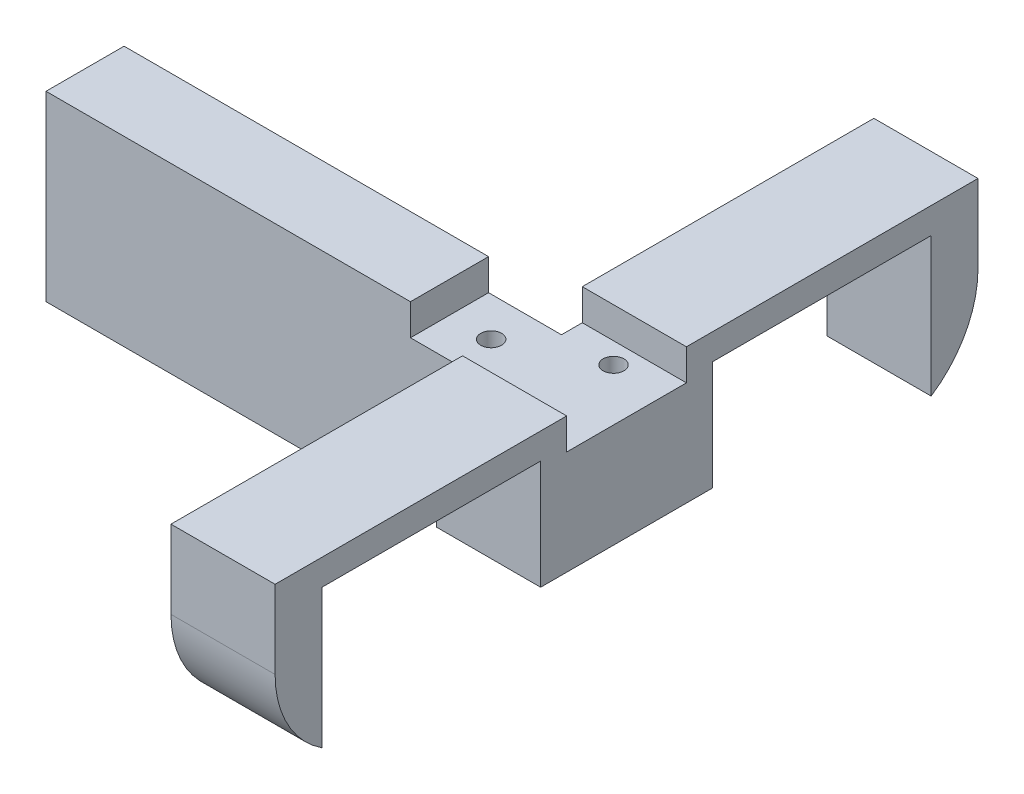
from build123d import *

# Parameters (mm, degrees)
BOSS_EXTRUDE1_DEPTH = 35
CUT_EXTRUDE1_REACH  = 163.307
SKETCH2_W           = 42
SKETCH2_H           = 21
SKETCH3_R           = 2
CUT_EXTRUDE2_DEPTH  = 10
FILLET1_R           = 20
CUT_EXTRUDE5_REACH  = 163.307
SKETCH6_W           = 42
SKETCH6_H           = 9
SKETCH7_R           = 2
CUT_EXTRUDE6_DEPTH  = 10
CUT_EXTRUDE7_DEPTH  = 9
SKETCH9_R           = 2
CUT_EXTRUDE8_DEPTH  = 10
CUT_EXTRUDE9_DEPTH  = 6
SKETCH11_R          = 2
CUT_EXTRUDE10_DEPTH = 9


with BuildPart() as part:
    # Sketch1 → Boss-Extrude1 (new body)
    with BuildSketch(Plane(origin=(0, 0, 0), x_dir=(1, 0, 0), z_dir=(0, 1, 0))):
        Polygon((-38.317617866, 43.23325062), (45.682382134, 43.23325062), (45.682382134, -16.76674938), (65.682382134, -16.76674938), (65.682382134, 118.23325062), (45.682382134, 118.23325062), (45.682382134, 58.23325062), (-38.317617866, 58.23325062), align=None)
    extrude(amount=BOSS_EXTRUDE1_DEPTH)

    # Sketch2 → Cut-Extrude1 (cut, up to next)
    with BuildSketch(Plane(origin=(65.682382134, 0, 0), x_dir=(0, 0, -1), z_dir=(1, 0, 0)), mode=Mode.PRIVATE) as cut_extrude1_sk1:
        with Locations((13.23325062, 19.5)):
            Rectangle(SKETCH2_W, SKETCH2_H)
    cut_extrude1_tool1 = extrude(cut_extrude1_sk1.sketch, amount=-CUT_EXTRUDE1_REACH, mode=Mode.PRIVATE) & part.part
    # Sketch2 → Cut-Extrude1 (cut, up to next)
    with BuildSketch(Plane(origin=(65.682382134, 0, 0), x_dir=(0, 0, -1), z_dir=(1, 0, 0)), mode=Mode.PRIVATE) as cut_extrude1_sk2:
        with Locations((88.23325062, 19.5)):
            Rectangle(SKETCH2_W, SKETCH2_H)
    cut_extrude1_tool2 = extrude(cut_extrude1_sk2.sketch, amount=-CUT_EXTRUDE1_REACH, mode=Mode.PRIVATE) & part.part
    add(cut_extrude1_tool1.solids().sort_by_distance((65.682382, 19.5, -13.233251))[0], mode=Mode.SUBTRACT)
    add(cut_extrude1_tool2.solids().sort_by_distance((65.682382, 19.5, -88.233251))[0], mode=Mode.SUBTRACT)

    # Sketch3 → Cut-Extrude2 (cut)
    with BuildSketch(Plane.ZY.offset(-45.682382134)):
        with Locations((11.26674938, 24.75)):
            Circle(SKETCH3_R)
        with Locations((11.26674938, 15.25)):
            Circle(SKETCH3_R)
        with Locations((-37.73325062, 24.75)):
            Circle(SKETCH3_R)
        with Locations((-37.73325062, 15.25)):
            Circle(SKETCH3_R)
        with Locations(Location((-112.73325062, 24.75, 0), (0, 0, 180))):
            Circle(SKETCH3_R)
        with Locations(Location((-112.73325062, 15.25, 0), (0, 0, 180))):
            Circle(SKETCH3_R)
        with Locations(Location((-63.73325062, 15.25, 0), (0, 0, 180))):
            Circle(SKETCH3_R)
        with Locations(Location((-63.73325062, 24.75, 0), (0, 0, 180))):
            Circle(SKETCH3_R)
    extrude(amount=-CUT_EXTRUDE2_DEPTH, mode=Mode.SUBTRACT)

    # Fillet1
    fillet1_edges = [part.edges().sort_by_distance(p)[0] for p in [
        (55.682382134, 0, -118.23325062),
        (55.682382134, 0, 16.76674938),
    ]]
    fillet(fillet1_edges, radius=FILLET1_R)

    # Sketch6 → Cut-Extrude5 (cut, up to next)
    with BuildSketch(Plane(origin=(65.682382134, 0, 0), x_dir=(0, 0, -1), z_dir=(1, 0, 0)), mode=Mode.PRIVATE) as cut_extrude5_sk1:
        with Locations((13.23325062, 4.5)):
            Rectangle(SKETCH6_W, SKETCH6_H)
    cut_extrude5_tool1 = extrude(cut_extrude5_sk1.sketch, amount=-CUT_EXTRUDE5_REACH, mode=Mode.PRIVATE) & part.part
    # Sketch6 → Cut-Extrude5 (cut, up to next)
    with BuildSketch(Plane(origin=(65.682382134, 0, 0), x_dir=(0, 0, -1), z_dir=(1, 0, 0)), mode=Mode.PRIVATE) as cut_extrude5_sk2:
        with Locations((88.23325062, 4.5)):
            Rectangle(SKETCH6_W, SKETCH6_H)
    cut_extrude5_tool2 = extrude(cut_extrude5_sk2.sketch, amount=-CUT_EXTRUDE5_REACH, mode=Mode.PRIVATE) & part.part
    add(cut_extrude5_tool1.solids().sort_by_distance((65.682382, 4.5, -13.233251))[0], mode=Mode.SUBTRACT)
    add(cut_extrude5_tool2.solids().sort_by_distance((65.682382, 4.5, -88.233251))[0], mode=Mode.SUBTRACT)

    # Sketch7 → Cut-Extrude6 (cut)
    with BuildSketch(Plane.ZY.offset(38.317617866)):
        with Locations((-50.73325062, 25)):
            Circle(SKETCH7_R)
        with Locations((-50.73325062, 10)):
            Circle(SKETCH7_R)
    extrude(amount=-CUT_EXTRUDE6_DEPTH, mode=Mode.SUBTRACT)

    # Sketch8 → Cut-Extrude7 (cut)
    with BuildSketch(Plane.XZ):
        Polygon((45.682382134, -67.23325062), (45.682382134, -58.23325062), (25.682382134, -58.23325062), (25.682382134, -43.23325062), (45.682382134, -43.23325062), (45.682382134, -34.23325062), (65.682382134, -34.23325062), (65.682382134, -67.23325062), align=None)
    extrude(amount=-CUT_EXTRUDE7_DEPTH, mode=Mode.SUBTRACT)

    # Sketch9 → Cut-Extrude8 (cut)
    with BuildSketch(Plane.XZ.offset(-9)):
        with Locations(Location((55.682382134, -42.23325062, 0), (0, 0, 270))):
            Circle(SKETCH9_R)
        with Locations(Location((55.682382134, -59.23325062, 0), (0, 0, 270))):
            Circle(SKETCH9_R)
        with Locations(Location((35.682382134, -50.73325062, 0), (0, 0, 270))):
            Circle(SKETCH9_R)
    extrude(amount=-CUT_EXTRUDE8_DEPTH, mode=Mode.SUBTRACT)

    # Sketch10 → Cut-Extrude9 (cut)
    with BuildSketch(Plane(origin=(0, 35, 0), x_dir=(1, 0, 0), z_dir=(0, 1, 0))):
        Polygon((45.682382134, 62.23325062), (65.682382134, 62.23325062), (65.682382134, 39.23325062), (45.682382134, 39.23325062), (45.682382134, 43.23325062), (31.682382134, 43.23325062), (31.682382134, 58.23325062), (45.682382134, 58.23325062), align=None)
    extrude(amount=-CUT_EXTRUDE9_DEPTH, mode=Mode.SUBTRACT)

    # Sketch11 → Cut-Extrude10 (cut)
    with BuildSketch(Plane(origin=(0, 29, 0), x_dir=(1, 0, 0), z_dir=(0, 1, 0))):
        with Locations(Location((55.682382134, 58.23325062, 0), (0, 0, 270))):
            Circle(SKETCH11_R)
        with Locations(Location((55.682382134, 43.23325062, 0), (0, 0, 270))):
            Circle(SKETCH11_R)
        with Locations(Location((39.682382134, 50.73325062, 0), (0, 0, 270))):
            Circle(SKETCH11_R)
    extrude(amount=-CUT_EXTRUDE10_DEPTH, mode=Mode.SUBTRACT)


solid = part.part
